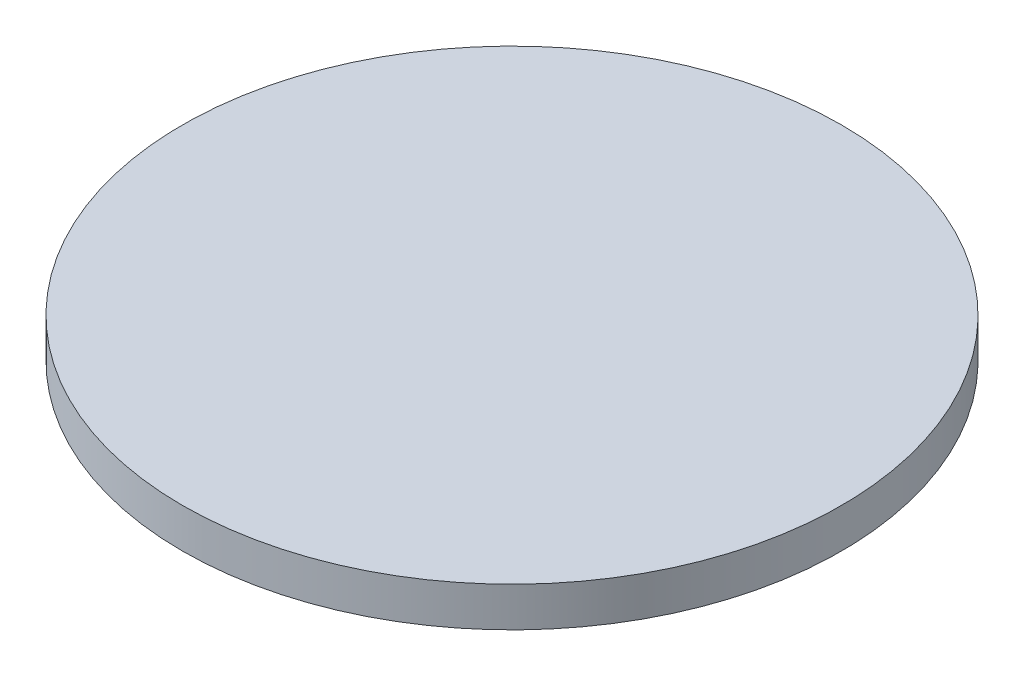
from build123d import *

# Parameters (mm, degrees)
SCHIZZO1_R                   = 50
ESTRUSIONE_ESTRUSIONE1_DEPTH = 6


with BuildPart() as part:
    # Schizzo1 → Estrusione-Estrusione1 (new body)
    with BuildSketch(Plane(origin=(0, 0, 0), x_dir=(1, 0, 0), z_dir=(0, 1, 0))):
        with Locations(Location((0, 0, 0), (0, 0, 270))):
            Circle(SCHIZZO1_R)
    extrude(amount=ESTRUSIONE_ESTRUSIONE1_DEPTH)


solid = part.part
